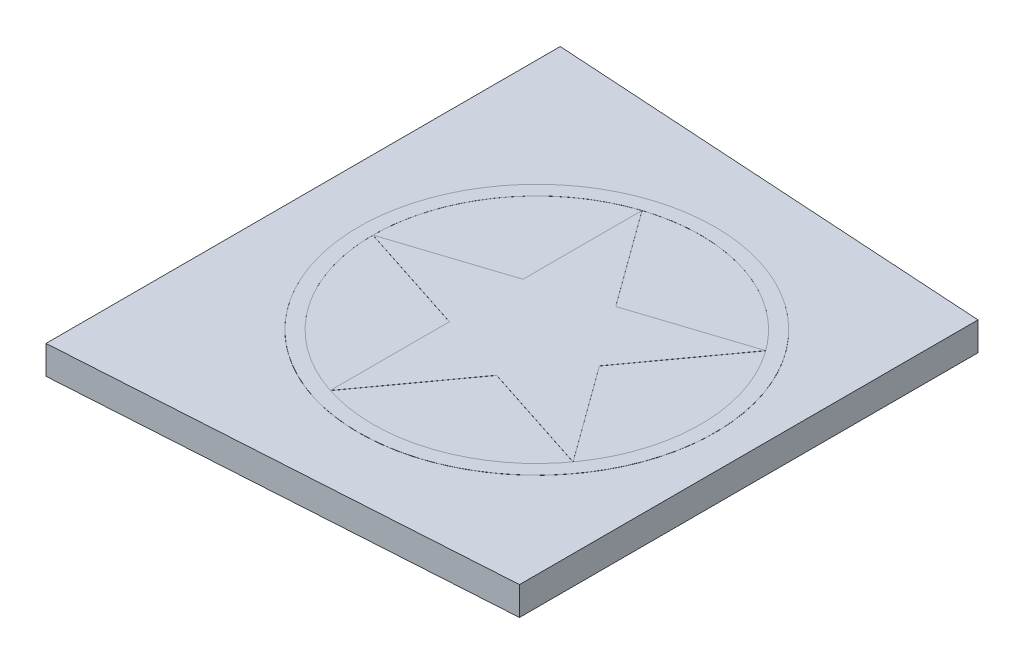
from build123d import *

# Parameters (mm, degrees)
BOSS_EXTRUDE1_DEPTH = 10
SKETCH3_R           = 4.62
CUT_EXTRUDE3_DEPTH  = 6
SKETCH4_R           = 62.5
SKETCH4_R_2         = 57.5
BOSS_EXTRUDE2_DEPTH = 0.05


with BuildPart() as part:
    # Sketch1 → Boss-Extrude1 (new body)
    with BuildSketch(Plane(origin=(0, 0, 0), x_dir=(1, 0, 0), z_dir=(0, 1, 0))):
        Polygon((-180.91295082, 131.617868852), (-180.91295082, -48.802131148), (-24.57295082, -39.020839837), (-24.57295082, 121.836577542), align=None)
    extrude(amount=BOSS_EXTRUDE1_DEPTH)

    # Sketch3 → Cut-Extrude3 (cut)
    with BuildSketch(Plane(origin=(7.497080179, 0, -119.83014083), x_dir=(-0.9980485856506585, 0, -0.062442138662287344), z_dir=(0.062442138662287344, 0, -0.9980485856506585))):
        with Locations((181.778415909, 4.88)):
            Circle(SKETCH3_R)
    extrude(amount=-CUT_EXTRUDE3_DEPTH, mode=Mode.SUBTRACT)

    # Sketch4 → Boss-Extrude2 (add)
    # profile 1 of 2: a face of its own
    with BuildSketch(Plane(origin=(0, 10, 0), x_dir=(1, 0, 0), z_dir=(0, 1, 0))):
        with Locations(Location((-98.92295082, 41.407868852, 0), (0, 0, 90))):
            Circle(SKETCH4_R)
        with Locations(Location((-98.92295082, 41.407868852, 0), (0, 0, 270))):
            Circle(SKETCH4_R_2, mode=Mode.SUBTRACT)
    # profile 2 of 2: a face of its own
    with BuildSketch(Plane(origin=(0, 10, 0), x_dir=(1, 0, 0), z_dir=(0, 1, 0))):
        Polygon((-76.965923859, 41.406760564), (-52.409995832, 75.197921831), (-92.136802298, 62.289899942), (-116.685907341, 96.086018397), (-116.685907341, 54.314782109), (-156.414016678, 41.410770734), (-116.687210213, 28.502748845), (-116.691427048, -13.26848723), (-92.138910388, 20.525152803), (-52.413407199, 7.613120531), align=None)
    extrude(amount=BOSS_EXTRUDE2_DEPTH)


solid = part.part
